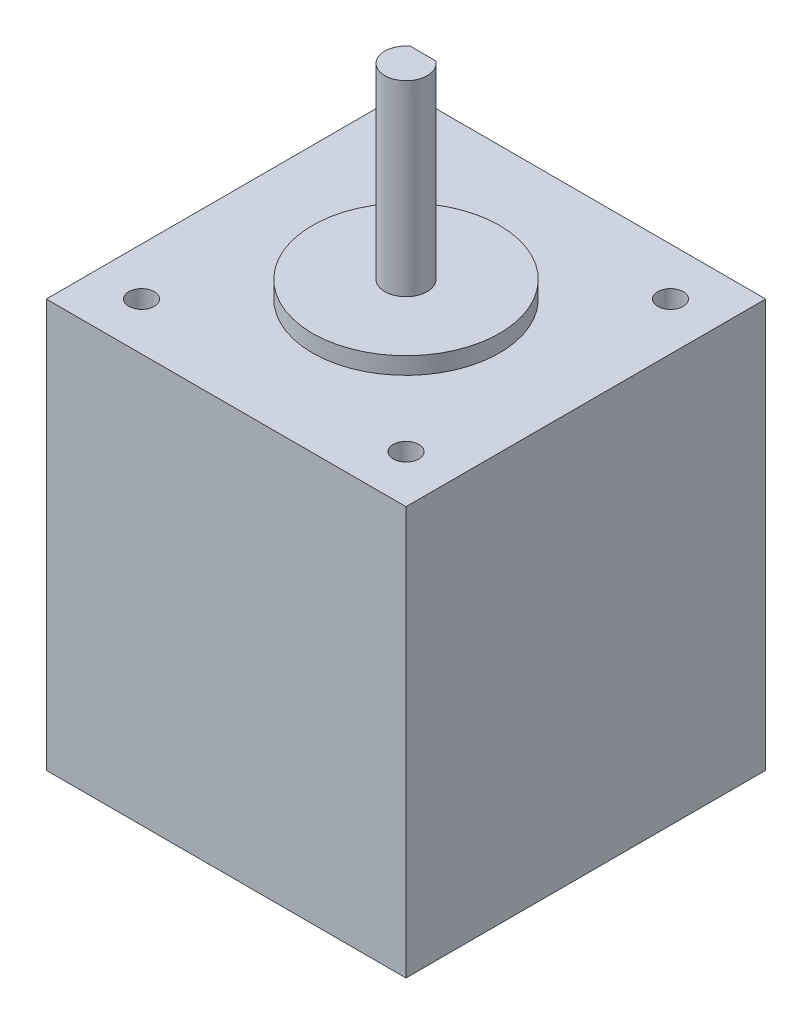
from build123d import *

# Parameters (mm, degrees)
SKIZZE1_W                       = 42.3
SKIZZE1_H                       = 42.3
AUFSATZ_LINEAR_AUSTRAGEN1_DEPTH = 48
SKIZZE2_R                       = 11
AUFSATZ_LINEAR_AUSTRAGEN2_DEPTH = 2
SKIZZE3_R                       = 2.5
AUFSATZ_LINEAR_AUSTRAGEN3_DEPTH = 22
SKIZZE4_W                       = 5
SKIZZE4_H                       = 0.5
SCHNITT_LINEAR_AUSTRAGEN1_DEPTH = 15
SKIZZE6_R                       = 1.5
SCHNITT_LINEAR_AUSTRAGEN2_DEPTH = 4.5


with BuildPart() as part:
    # Skizze1 → Aufsatz-Linear austragen1 (new body)
    with BuildSketch(Plane.XZ.offset(-25)):
        with Locations((0, 43.45)):
            Rectangle(SKIZZE1_W, SKIZZE1_H)
    extrude(amount=AUFSATZ_LINEAR_AUSTRAGEN1_DEPTH)

    # Skizze2 → Aufsatz-Linear austragen2 (add)
    with BuildSketch(Plane(origin=(0, 25, 0), x_dir=(1, 0, 0), z_dir=(0, 1, 0))):
        with Locations((0, -43.45)):
            Circle(SKIZZE2_R)
    extrude(amount=AUFSATZ_LINEAR_AUSTRAGEN2_DEPTH)

    # Skizze3 → Aufsatz-Linear austragen3 (add)
    with BuildSketch(Plane(origin=(0, 27, 0), x_dir=(1, 0, 0), z_dir=(0, 1, 0))):
        with Locations((0, -43.45)):
            Circle(SKIZZE3_R)
    extrude(amount=AUFSATZ_LINEAR_AUSTRAGEN3_DEPTH)

    # Skizze4 → Schnitt-Linear austragen1 (cut)
    with BuildSketch(Plane(origin=(0, 49, 0), x_dir=(1, 0, 0), z_dir=(0, 1, 0))):
        with Locations((0, -41.2)):
            Rectangle(SKIZZE4_W, SKIZZE4_H)
    extrude(amount=-SCHNITT_LINEAR_AUSTRAGEN1_DEPTH, mode=Mode.SUBTRACT)

    # Skizze6 → Schnitt-Linear austragen2 (cut)
    with BuildSketch(Plane(origin=(0, 25, 0), x_dir=(1, 0, 0), z_dir=(0, 1, 0))):
        with Locations((-15.55, -27.9)):
            Circle(SKIZZE6_R)
        with Locations((-15.55, -59)):
            Circle(SKIZZE6_R)
    schnitt_linear_austragen2 = extrude(amount=-SCHNITT_LINEAR_AUSTRAGEN2_DEPTH, mode=Mode.SUBTRACT)

    # Spiegeln1: Schnitt-Linear austragen2 across plane
    add(schnitt_linear_austragen2.mirror(Plane.ZY), mode=Mode.SUBTRACT)


solid = part.part
